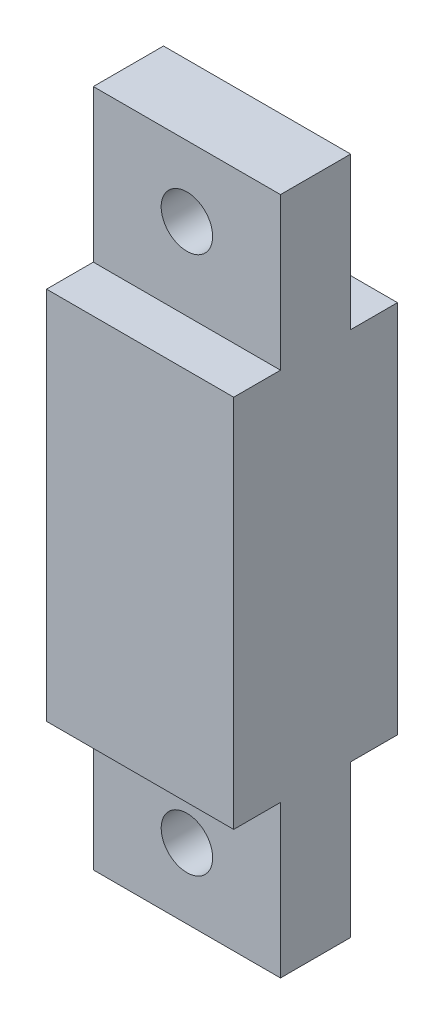
from build123d import *

# Parameters (mm, degrees)
SKETCH_1_W            = 8
SKETCH_1_H            = 29
EXTRUDE_272_DEPTH     = 3
SKETCH_2_W            = 8
SKETCH_2_H            = 16
EXTRUDE_392_DEPTH     = 2
EXTRUDE_START         = 3
SKETCH_2_2_W          = 8
SKETCH_2_2_H          = 16
EXTRUDE_443_DEPTH     = 2
CUT_EXTRUDE_679_REACH = 17.851
SKETCH_3_R            = 1.1


with BuildPart() as part:
    # 草图1 → Extrude 272 (new body)
    with BuildSketch(Plane.XY):
        Rectangle(SKETCH_1_W, SKETCH_1_H)
    extrude(amount=EXTRUDE_272_DEPTH)

    # 草图2 → Extrude 392 (add)
    with BuildSketch(Plane.XY):
        Rectangle(SKETCH_2_W, SKETCH_2_H)
    extrude(amount=-EXTRUDE_392_DEPTH)

    # 草图2<2> → Extrude 443 (add)
    with BuildSketch(Plane.XY.offset(EXTRUDE_START)):
        Rectangle(SKETCH_2_2_W, SKETCH_2_2_H)
    extrude(amount=EXTRUDE_443_DEPTH)

    # 草图3 → Cut-Extrude 679 (cut, up to next)
    with BuildSketch(Plane.XY.offset(3), mode=Mode.PRIVATE) as cut_extrude_679_sk1:
        with Locations((0, 11.5)):
            Circle(SKETCH_3_R)
    cut_extrude_679_tool1 = extrude(cut_extrude_679_sk1.sketch, amount=-CUT_EXTRUDE_679_REACH, mode=Mode.PRIVATE) & part.part
    # 草图3 → Cut-Extrude 679 (cut, up to next)
    with BuildSketch(Plane.XY.offset(3), mode=Mode.PRIVATE) as cut_extrude_679_sk2:
        with Locations((0, -11.5)):
            Circle(SKETCH_3_R)
    cut_extrude_679_tool2 = extrude(cut_extrude_679_sk2.sketch, amount=-CUT_EXTRUDE_679_REACH, mode=Mode.PRIVATE) & part.part
    add(cut_extrude_679_tool1.solids().sort_by_distance((0, 11.5, 3))[0], mode=Mode.SUBTRACT)
    add(cut_extrude_679_tool2.solids().sort_by_distance((0, -11.5, 3))[0], mode=Mode.SUBTRACT)


solid = part.part
